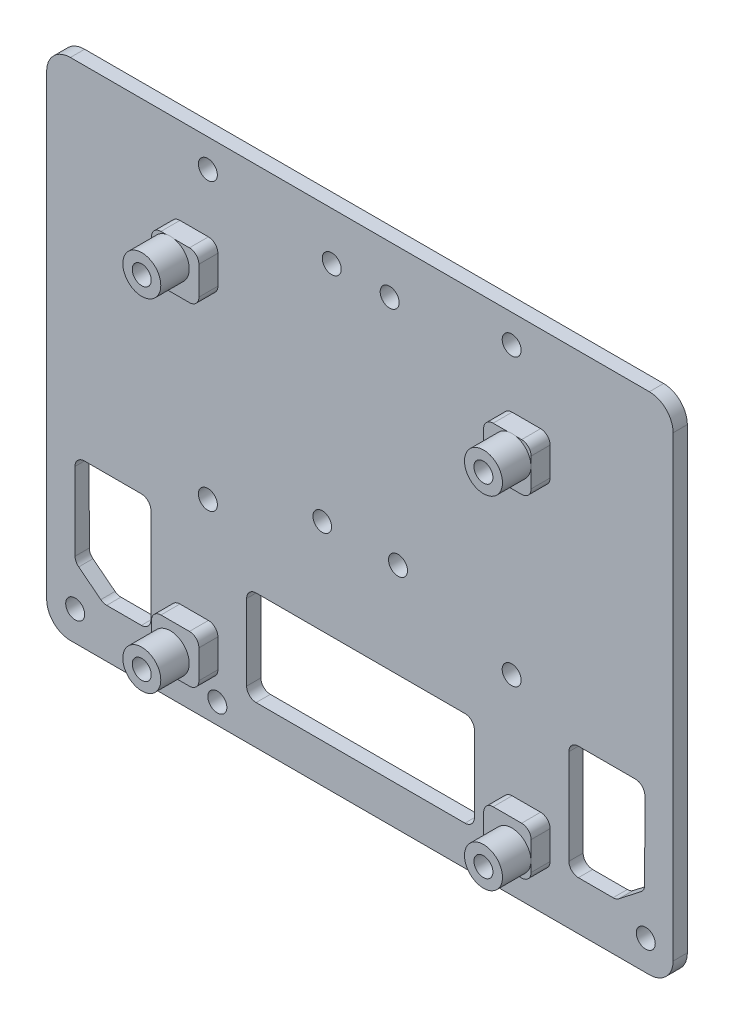
from build123d import *

# Parameters (mm, degrees)
SKETCH1_W           = 66
SKETCH1_H           = 53.2
SKETCH1_R           = 1
SKETCH1_R_2         = 0.98333
SKETCH1_R_3         = 1.011270727
BOSS_EXTRUDE1_DEPTH = 1.5
SKETCH2_W           = 5
SKETCH2_H           = 5
BOSS_EXTRUDE2_DEPTH = 2
FILLET1_R           = 1
FILLET2_R           = 2.5
SKETCH3_R           = 2
BOSS_EXTRUDE3_DEPTH = 3
SKETCH4_R           = 1
CUT_EXTRUDE1_DEPTH  = 384.370615534
SKETCH5_W           = 24
SKETCH5_H           = 10
CUT_EXTRUDE2_DEPTH  = 3
FILLET3_R           = 1


with BuildPart() as part:
    # Sketch1 → Boss-Extrude1 (new body)
    with BuildSketch(Plane.XY.offset(10)):
        with Locations((177.963936399, 293.439054482)):
            Rectangle(SKETCH1_W, SKETCH1_H)
        with Locations((161.947495, 317.06050799)):
            Circle(SKETCH1_R, mode=Mode.SUBTRACT)
        with Locations((193.956452611, 317.06050799)):
            Circle(SKETCH1_R, mode=Mode.SUBTRACT)
        with Locations((174.997800233, 314.982847455)):
            Circle(SKETCH1_R, mode=Mode.SUBTRACT)
        with Locations((181.100928053, 314.982847455)):
            Circle(SKETCH1_R, mode=Mode.SUBTRACT)
        with Locations((173.997800233, 290.965333254)):
            Circle(SKETCH1_R_2, mode=Mode.SUBTRACT)
        with Locations((181.983306885, 290.965333254)):
            Circle(SKETCH1_R, mode=Mode.SUBTRACT)
        with Locations((161.947495, 286.962677261)):
            Circle(SKETCH1_R, mode=Mode.SUBTRACT)
        with Locations((193.956452611, 286.962677261)):
            Circle(SKETCH1_R, mode=Mode.SUBTRACT)
        with Locations((162.947495, 268.970540104)):
            Circle(SKETCH1_R, mode=Mode.SUBTRACT)
        with Locations((192.956452611, 268.970540104)):
            Circle(SKETCH1_R_3, mode=Mode.SUBTRACT)
        with Locations((208.084556857, 269.981810832)):
            Circle(SKETCH1_R, mode=Mode.SUBTRACT)
        with Locations((147.966567684, 269.970540104)):
            Circle(SKETCH1_R, mode=Mode.SUBTRACT)
    extrude(amount=BOSS_EXTRUDE1_DEPTH)

    # Sketch2 → Boss-Extrude2 (add)
    with BuildSketch(Plane.XY.offset(11.5)):
        with Locations((195.50417089, 308.439334712)):
            Rectangle(SKETCH2_W, SKETCH2_H)
        with Locations((160.50417089, 308.439334712)):
            Rectangle(SKETCH2_W, SKETCH2_H)
        with Locations((195.50417089, 273.439334712)):
            Rectangle(SKETCH2_W, SKETCH2_H)
        with Locations((160.50417089, 273.439334712)):
            Rectangle(SKETCH2_W, SKETCH2_H)
    extrude(amount=BOSS_EXTRUDE2_DEPTH)

    # Fillet1
    fillet1_edges = [part.edges().sort_by_distance(p)[0] for p in [
        (163.00417089, 275.939334712, 12.5),
        (158.00417089, 275.939334712, 12.5),
        (158.00417089, 270.939334712, 12.5),
        (163.00417089, 270.939334712, 12.5),
        (158.00417089, 310.939334712, 12.5),
        (158.00417089, 305.939334712, 12.5),
        (163.00417089, 305.939334712, 12.5),
        (163.00417089, 310.939334712, 12.5),
        (198.00417089, 310.939334712, 12.5),
        (193.00417089, 310.939334712, 12.5),
        (193.00417089, 305.939334712, 12.5),
        (198.00417089, 305.939334712, 12.5),
        (198.00417089, 275.939334712, 12.5),
        (193.00417089, 275.939334712, 12.5),
        (193.00417089, 270.939334712, 12.5),
        (198.00417089, 270.939334712, 12.5),
    ]]
    fillet(fillet1_edges, radius=FILLET1_R)

    # Fillet2
    fillet2_edges = [part.edges().sort_by_distance(p)[0] for p in [
        (144.963936399, 320.039054482, 10.75),
        (210.963936399, 320.039054482, 10.75),
        (210.963936399, 266.839054482, 10.75),
        (144.963936399, 266.839054482, 10.75),
    ]]
    fillet(fillet2_edges, radius=FILLET2_R)

    # Sketch3 → Boss-Extrude3 (add)
    with BuildSketch(Plane.XY.offset(13.5)):
        with Locations(Location((159.986771392, 308.993272747, 0), (0, 0, 187.563213286))):
            Circle(SKETCH3_R)
        with Locations(Location((195.986771392, 308.993272747, 0), (0, 0, 103.336783262))):
            Circle(SKETCH3_R)
        with Locations((195.986771392, 272.993272747)):
            Circle(SKETCH3_R)
        with Locations(Location((159.986771392, 272.993272747, 0), (0, 0, 187.563213286))):
            Circle(SKETCH3_R)
    extrude(amount=BOSS_EXTRUDE3_DEPTH)

    # Sketch4 → Cut-Extrude1 (cut, through all)
    with BuildSketch(Plane.XY.offset(16.5)):
        with Locations((159.979889168, 308.96706871)):
            Circle(SKETCH4_R)
        with Locations((195.979889168, 308.96706871)):
            Circle(SKETCH4_R)
        with Locations((195.979889168, 272.96706871)):
            Circle(SKETCH4_R)
        with Locations((159.979889168, 272.96706871)):
            Circle(SKETCH4_R)
    extrude(amount=-CUT_EXTRUDE1_DEPTH, mode=Mode.SUBTRACT)

    # Sketch5 → Cut-Extrude2 (cut)
    with BuildSketch(Plane.XY.offset(11.5)):
        Polygon((199.987014771, 283.959443526), (207.987014771, 283.959443526), (207.970870972, 274.289443526), (204.987014771, 271.959443526), (199.987014771, 271.959443526), align=None)
        Polygon((150.940858028, 271.959443526), (155.940858028, 271.959443526), (155.940858028, 283.959443526), (147.940858028, 283.959443526), (147.957001827, 274.289443526), align=None)
        with Locations((178.030567575, 275.960587895)):
            Rectangle(SKETCH5_W, SKETCH5_H)
    extrude(amount=-CUT_EXTRUDE2_DEPTH, mode=Mode.SUBTRACT)

    # Fillet3
    fillet3_edges = [part.edges().sort_by_distance(p)[0] for p in [
        (199.987014771, 271.959443526, 10.75),
        (199.987014771, 283.959443526, 10.75),
        (207.987014771, 283.959443526, 10.75),
        (207.970870972, 274.289443526, 10.75),
        (204.987014771, 271.959443526, 10.75),
        (150.940858028, 271.959443526, 10.75),
        (147.957001827, 274.289443526, 10.75),
        (147.940858028, 283.959443526, 10.75),
        (155.940858028, 283.959443526, 10.75),
        (155.940858028, 271.959443526, 10.75),
        (166.030567575, 270.960587895, 10.75),
        (166.030567575, 280.960587895, 10.75),
        (190.030567575, 280.960587895, 10.75),
        (190.030567575, 270.960587895, 10.75),
    ]]
    fillet(fillet3_edges, radius=FILLET3_R)


solid = part.part
